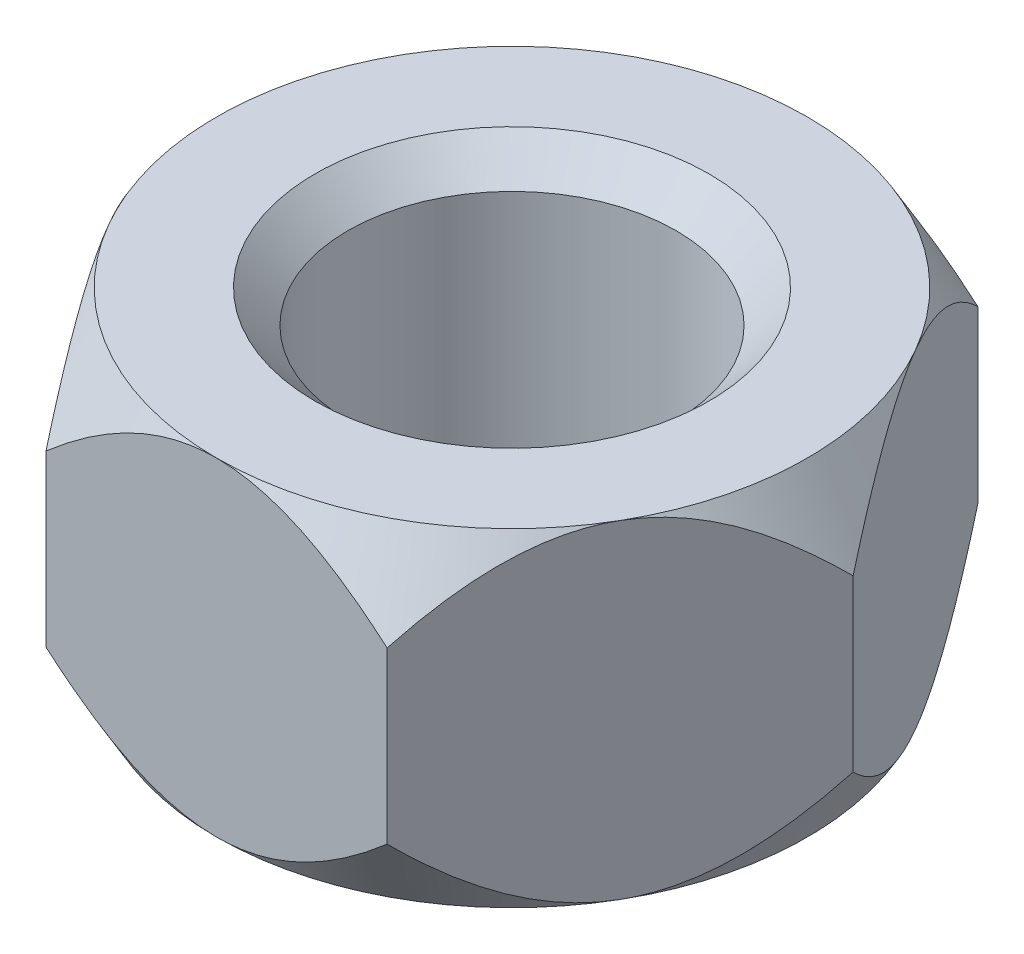
from build123d import *

# Parameters (mm, degrees)
EXTRUDE_1_DEPTH     = 5
SKETCH_2_R          = 2.5
CUT_EXTRUDE_1_DEPTH = 5
SKETCH_3_OUTSIDE_W  = 21.092
SKETCH_3_OUTSIDE_H  = 19.7
SKETCH_3_OUTSIDE_R  = 4.5
CUT_EXTRUDE_2_DEPTH = 5
CUT_EXTRUDE_2_DRAFT = -30
SKETCH_4_OUTSIDE_W  = 21.092
SKETCH_4_OUTSIDE_H  = 19.7
SKETCH_4_OUTSIDE_R  = 4.5
CUT_EXTRUDE_3_DEPTH = 5
CUT_EXTRUDE_3_DRAFT = -30
CHAMFER_1_SIZE      = 0.5
CHAMFER_2_SIZE      = 0.5


with BuildPart() as part:
    # 草图1 → 凸台-拉伸1 (new body)
    with BuildSketch(Plane(origin=(0, 0, 0), x_dir=(1, 0, 0), z_dir=(0, 1, 0))):
        Polygon((2.598076211, 4.5), (-2.598076211, 4.5), (-5.196152423, 0), (-2.598076211, -4.5), (2.598076211, -4.5), (5.196152423, 0), align=None)
    extrude(amount=EXTRUDE_1_DEPTH)

    # 草图2 → 切除-拉伸1 (cut)
    with BuildSketch(Plane(origin=(0, 5, 0), x_dir=(1, 0, 0), z_dir=(0, 1, 0))):
        with Locations(Location((0, 0, 0), (0, 0, 270))):
            Circle(SKETCH_2_R)
    extrude(amount=-CUT_EXTRUDE_1_DEPTH, mode=Mode.SUBTRACT)


with BuildPart() as cut_extrude_2_tool:
    # 草图3 outside → 切除-拉伸2 (with draft: the straight prism first)
    with BuildSketch(Plane(origin=(0, 5, 0), x_dir=(1, 0, 0), z_dir=(0, 1, 0))):
        Rectangle(SKETCH_3_OUTSIDE_W, SKETCH_3_OUTSIDE_H)
        Circle(SKETCH_3_OUTSIDE_R, mode=Mode.SUBTRACT)
    extrude(amount=-CUT_EXTRUDE_2_DEPTH)
    # 切除-拉伸2: the draft: its side faces are tilted about the plane it starts from
    cut_extrude_2_sides = [cut_extrude_2_tool.faces().sort_by_distance(p)[0] for p in [
        (0, 2.5, 9.85),
        (10.546, 2.5, 0),
        (0, 2.5, -9.85),
        (-10.546, 2.5, 0),
        (-4.5, 2.5, 0),
    ]]
    draft(cut_extrude_2_sides, Plane(origin=(0, 5, 0), x_dir=(1, 0, 0), z_dir=(0, 1, 0)), CUT_EXTRUDE_2_DRAFT)


with BuildPart() as part_1:
    add(part.part)

    # 切除-拉伸2: cut by cut_extrude_2_tool
    add(cut_extrude_2_tool.part, mode=Mode.SUBTRACT)


with BuildPart() as cut_extrude_3_tool:
    # 草图4 outside → 切除-拉伸3 (with draft: the straight prism first)
    with BuildSketch(Plane.XZ):
        Rectangle(SKETCH_4_OUTSIDE_W, SKETCH_4_OUTSIDE_H)
        Circle(SKETCH_4_OUTSIDE_R, mode=Mode.SUBTRACT)
    extrude(amount=-CUT_EXTRUDE_3_DEPTH)
    # 切除-拉伸3: the draft: its side faces are tilted about the plane it starts from
    cut_extrude_3_sides = [cut_extrude_3_tool.faces().sort_by_distance(p)[0] for p in [
        (0, 2.5, -9.85),
        (10.546, 2.5, 0),
        (0, 2.5, 9.85),
        (-10.546, 2.5, 0),
        (-4.5, 2.5, 0),
    ]]
    draft(cut_extrude_3_sides, Plane.XZ, CUT_EXTRUDE_3_DRAFT)


with BuildPart() as part_2:
    add(part_1.part)

    # 切除-拉伸3: cut by cut_extrude_3_tool
    add(cut_extrude_3_tool.part, mode=Mode.SUBTRACT)

    # 倒角1
    chamfer_1_edges = [part_2.edges().sort_by_distance(p)[0] for p in [
        (0, 5, -2.5),
    ]]
    chamfer(chamfer_1_edges, length=CHAMFER_1_SIZE)

    # 倒角2
    chamfer_2_edges = [part_2.edges().sort_by_distance(p)[0] for p in [
        (0, 0, -2.5),
    ]]
    chamfer(chamfer_2_edges, length=CHAMFER_2_SIZE)


solid = part_2.part
